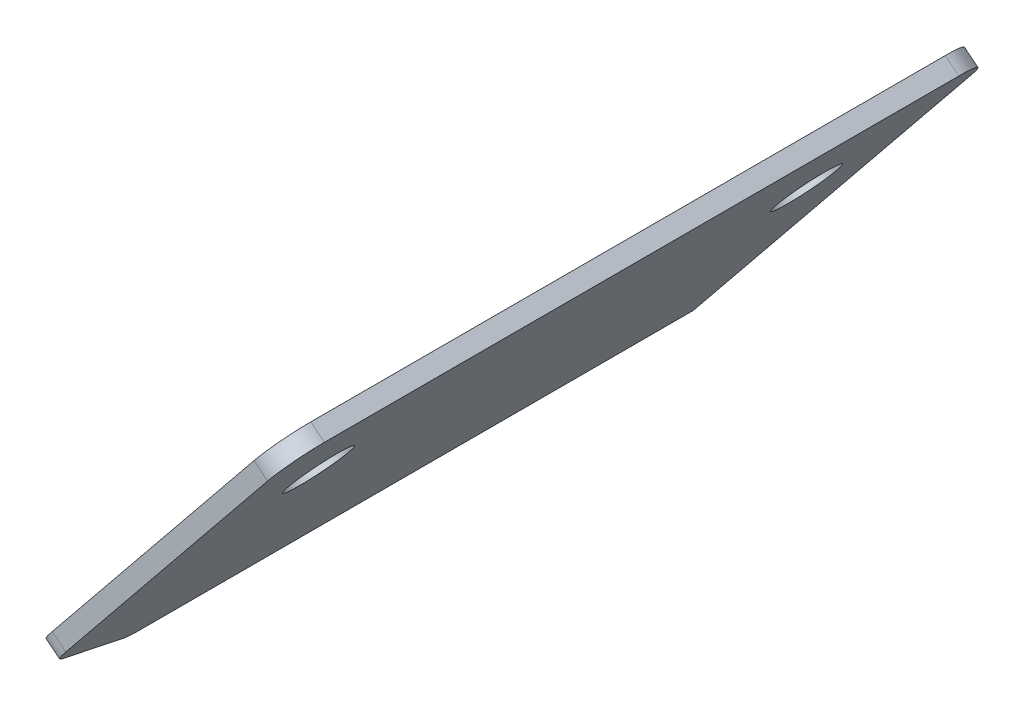
from build123d import *

# Parameters (mm, degrees)
BOSS_EXTRUDE1_DEPTH     = 256.54
CUT_EXTRUDE1_REACH      = 815.442
SKETCH2_R               = 11.1125
CUT_EXTRUDE2_DEPTH      = 814.446927228
CUT_EXTRUDE2_DEPTH_BACK = 814.446927228
FILLET1_R               = 12.7


with BuildPart() as part:
    # Sketch1 → Boss-Extrude1 (new body)
    with BuildSketch(Plane.XY):
        Polygon((-443.965929871, -405.988484906), (-553.446258124, -541.061617166), (-558.379343621, -537.063221553), (-448.899015368, -401.990089292), align=None)
    extrude(amount=BOSS_EXTRUDE1_DEPTH)

    # Sketch2 → Cut-Extrude1 (cut, up to next)
    with BuildSketch(Plane(origin=(-74.278193829, 60.204430788, 0), x_dir=(0, 0, 1), z_dir=(-0.7768638577795597, 0.6296686005160651, 0)), mode=Mode.PRIVATE) as cut_extrude1_sk1:
        with Locations(Location((213.995, -645.749186336, 0), (0, 0, 270))):
            Circle(SKETCH2_R)
    cut_extrude1_tool1 = extrude(cut_extrude1_sk1.sketch, amount=-CUT_EXTRUDE1_REACH, mode=Mode.PRIVATE) & part.part
    # Sketch2 → Cut-Extrude1 (cut, up to next)
    with BuildSketch(Plane(origin=(-74.278193829, 60.204430788, 0), x_dir=(0, 0, 1), z_dir=(-0.7768638577795597, 0.6296686005160651, 0)), mode=Mode.PRIVATE) as cut_extrude1_sk2:
        with Locations(Location((36.195, -645.749186336, 0), (0, 0, 270))):
            Circle(SKETCH2_R)
    cut_extrude1_tool2 = extrude(cut_extrude1_sk2.sketch, amount=-CUT_EXTRUDE1_REACH, mode=Mode.PRIVATE) & part.part
    add(cut_extrude1_tool1.solids().sort_by_distance((-480.88618, -441.454773, 213.995))[0], mode=Mode.SUBTRACT)
    add(cut_extrude1_tool2.solids().sort_by_distance((-480.88618, -441.454773, 36.195))[0], mode=Mode.SUBTRACT)

    # Sketch3 → Cut-Extrude2 (cut, two sides: drawn at the far end of the back side and taken through both)
    with BuildSketch(Plane(origin=(-69.345108332, 56.206035175, 0), x_dir=(0, 0, -1), z_dir=(0.7768638577795598, -0.6296686005160651, 0)).offset(-CUT_EXTRUDE2_DEPTH_BACK)):
        Polygon((269.008566256, -1124.880370714), (-205.74, -768.818946022), (-256.54, -730.718946022), (-731.288566256, -374.65752133), (-1443.411415639, -1324.154653842), (-443.114283128, -2074.377503225), align=None)
    extrude(amount=CUT_EXTRUDE2_DEPTH + CUT_EXTRUDE2_DEPTH_BACK, mode=Mode.SUBTRACT)

    # Fillet1
    fillet1_edges = [part.edges().sort_by_distance(p)[0] for p in [
        (-531.922427193, -509.463906378, 256.54),
        (-446.432472619, -403.989287099, 256.54),
        (-555.912800873, -539.062419359, 205.74),
        (-446.432472619, -403.989287099, 0),
    ]]
    fillet(fillet1_edges, radius=FILLET1_R)


solid = part.part
